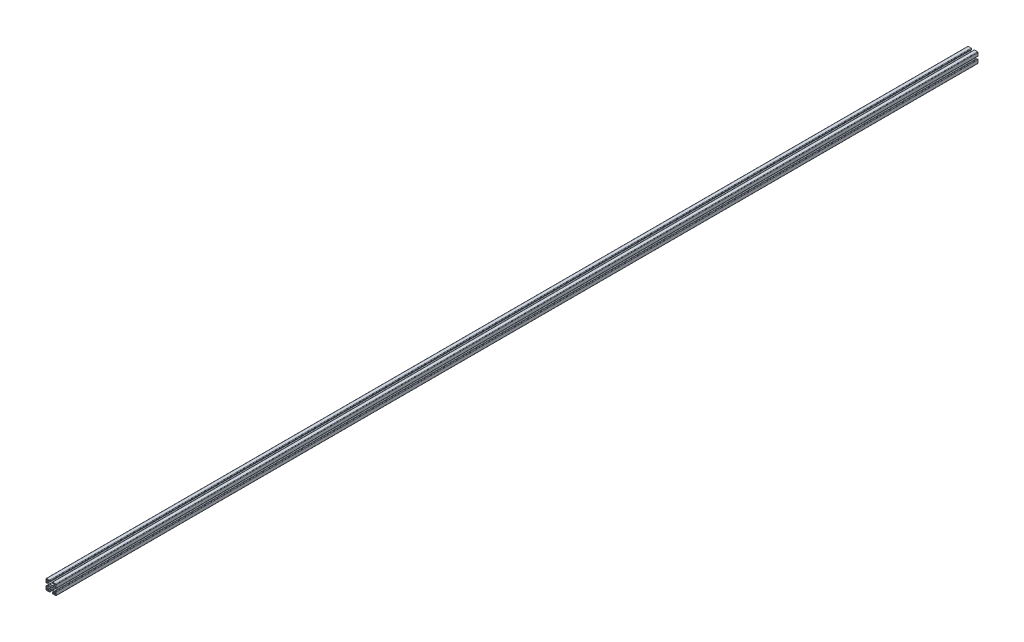
from build123d import *

# Parameters (mm, degrees)
CROQUIS1_W              = 40
CROQUIS1_H              = 40
SALIENTE_EXTRUIR1_DEPTH = 3600
CROQUIS2_W              = 6
CROQUIS2_H              = 6
CROQUIS2_R              = 3.5
CORTAR_EXTRUIR2_DEPTH   = 3600
REDONDEO1_R             = 2
REDONDEO2_R             = 2


with BuildPart() as part:
    # Croquis1 → Saliente-Extruir1 (new body)
    with BuildSketch(Plane.XY):
        Rectangle(CROQUIS1_W, CROQUIS1_H)
    extrude(amount=SALIENTE_EXTRUIR1_DEPTH)

    # Croquis2 → Cortar-Extruir2 (cut)
    with BuildSketch(Plane.XY.offset(3600)):
        with Locations((-15.5, 15.5)):
            Rectangle(CROQUIS2_W, CROQUIS2_H)
        Polygon((4.5, 15.5), (4.5, 20), (-4.5, 20), (-4.5, 15.5), (-7, 15.5), (-7, 18), (-11, 18), (-11, 12.767766953), (-5.733637236, 7.501404189), (5.733637236, 7.501404189), (11, 12.767766953), (11, 18), (7, 18), (7, 15.5), align=None)
        with Locations((15.5, 15.5)):
            Rectangle(CROQUIS2_W, CROQUIS2_H)
        Polygon((15.367588592, -4.5), (20, -4.5), (20, 4.5), (15.367588592, 4.5), (15.367588592, 7), (17.867588592, 7), (17.867588592, 11), (12.767766953, 11), (7.501349817, 5.733582864), (7.501349817, -5.733582864), (12.767766953, -11), (17.867588592, -11), (17.867588592, -7), (15.367588592, -7), align=None)
        Polygon((-20, 4.5), (-20, -4.5), (-15.367588592, -4.5), (-15.367588592, -7), (-17.867588592, -7), (-17.867588592, -11), (-12.767766953, -11), (-7.501349817, -5.733582864), (-7.501349817, 5.733582864), (-12.767766953, 11), (-17.867588592, 11), (-17.867588592, 7), (-15.367588592, 7), (-15.367588592, 4.5), align=None)
        Circle(CROQUIS2_R)
        Polygon((11, -12.767766953), (5.733637236, -7.501404189), (-5.733637236, -7.501404189), (-11, -12.767766953), (-11, -18), (-7, -18), (-7, -15.5), (-4.5, -15.5), (-4.5, -20), (4.5, -20), (4.5, -15.5), (7, -15.5), (7, -18), (11, -18), align=None)
        with Locations((-15.5, -15.5)):
            Rectangle(CROQUIS2_W, CROQUIS2_H)
        with Locations((15.5, -15.5)):
            Rectangle(CROQUIS2_W, CROQUIS2_H)
    extrude(amount=-CORTAR_EXTRUIR2_DEPTH, mode=Mode.SUBTRACT)

    # Redondeo1
    redondeo1_edges = [part.edges().sort_by_distance(p)[0] for p in [
        (20, -20, 1800),
        (-20, -20, 1800),
        (-20, 20, 1800),
        (20, 20, 1800),
    ]]
    fillet(redondeo1_edges, radius=REDONDEO1_R)

    # Redondeo2
    redondeo2_edges = [part.edges().sort_by_distance(p)[0] for p in [
        (4.5, 20, 1800),
        (-4.5, 20, 1800),
        (20, -4.5, 1800),
        (20, 4.5, 1800),
        (-20, 4.5, 1800),
        (-20, -4.5, 1800),
        (-4.5, -20, 1800),
        (4.5, -20, 1800),
    ]]
    fillet(redondeo2_edges, radius=REDONDEO2_R)


solid = part.part
